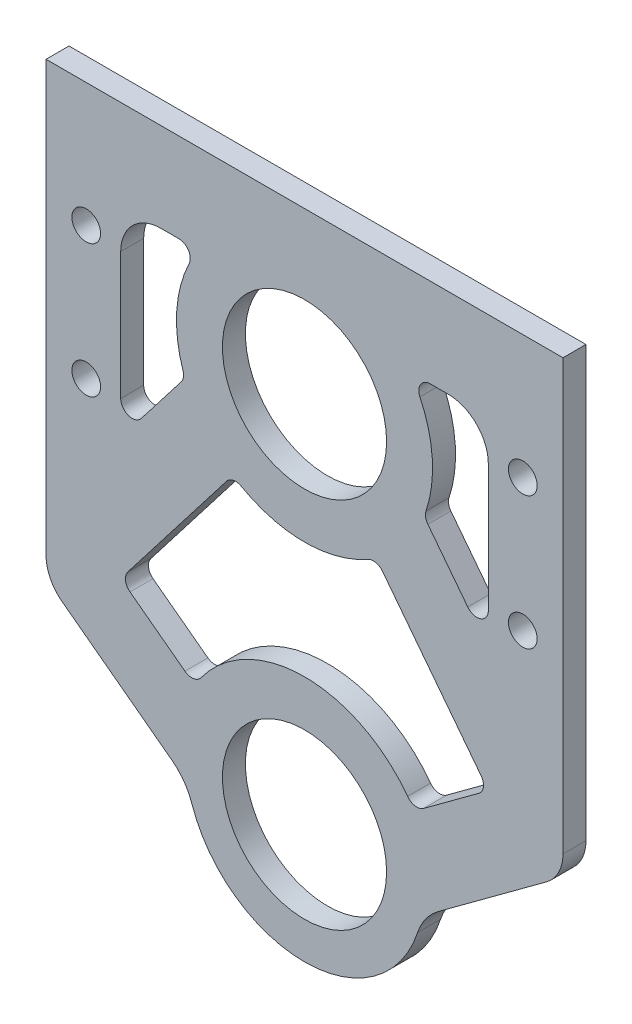
from build123d import *

# Parameters (mm, degrees)
SKETCH1_R           = 14.29
SKETCH1_R_2         = 2.5
BOSS_EXTRUDE1_DEPTH = 4


with BuildPart() as part:
    # Sketch1 → Boss-Extrude1 (new body)
    with BuildSketch(Plane.XY):
        with BuildLine():
            Line((42.153928026, 12.438673777), (23.259125181, -1.491803793))
            ThreePointArc((23.259125181, -1.491803793), (21.087687699, -3.684227098), (19.688057389, -6.434299039))
            ThreePointArc((19.688057389, -6.434299039), (17.183961156, -11.564224439), (13.374639809, -15.815777498))
            ThreePointArc((13.374639809, -15.815777498), (-5.55728281, -19.953356), (-19.624705783, -6.625007986))
            ThreePointArc((-19.624705783, -6.625007986), (-20.997947453, -3.961204504), (-23.098831149, -1.823933026))
            Line((-23.098831149, -1.823933026), (-42.200396688, 12.504304927))
            ThreePointArc((-42.200396688, 12.504304927), (-44.261108051, 14.973735796), (-45.00000949, 18.104014507))
            Line((-45.00000949, 18.104014507), (-45.00000949, 85.67919791))
            Line((-45.00000949, 85.67919791), (-45.00000949, 92.880351926))
            Line((-45.00000949, 92.880351926), (44.99999051, 92.880351926))
            Line((44.99999051, 92.880351926), (44.99999051, 90.002365232))
            Line((44.99999051, 90.002365232), (44.99999051, 18.072926444))
            ThreePointArc((44.99999051, 18.072926444), (44.248092726, 14.916786603), (42.153928026, 12.438673777))
        make_face()
        Circle(SKETCH1_R, mode=Mode.SUBTRACT)
        with Locations((0, 64.87)):
            Circle(SKETCH1_R, mode=Mode.SUBTRACT)
        with Locations((37.99999051, 48.238911282)):
            Circle(SKETCH1_R_2, mode=Mode.SUBTRACT)
        with Locations((37.99999051, 71.343473564)):
            Circle(SKETCH1_R_2, mode=Mode.SUBTRACT)
        with Locations(Location((-37.99999051, 48.238911282, 0), (0, 0, 180))):
            Circle(SKETCH1_R_2, mode=Mode.SUBTRACT)
        with Locations(Location((-37.99999051, 71.343473564, 0), (0, 0, 180))):
            Circle(SKETCH1_R_2, mode=Mode.SUBTRACT)
        with BuildLine():
            Line((13.574400229, 44.968526689), (30.750314435, 22.722318802))
            ThreePointArc((30.750314435, 22.722318802), (31.147959551, 21.222946572), (30.35409022, 19.890276241))
            Line((30.35409022, 19.890276241), (20.739573812, 12.80182942))
            ThreePointArc((20.739573812, 12.80182942), (19.25353688, 12.434122338), (17.942793433, 13.224986345))
            ThreePointArc((17.942793433, 13.224986345), (-0.05305295, 22.289936864), (-18.005544161, 13.139424624))
            ThreePointArc((-18.005544161, 13.139424624), (-19.325388182, 12.340361548), (-20.821226271, 12.718460012))
            Line((-20.821226271, 12.718460012), (-30.377654795, 19.886813915))
            ThreePointArc((-30.377654795, 19.886813915), (-31.159381655, 21.217806836), (-30.760607673, 22.708987023))
            Line((-30.760607673, 22.708987023), (-13.574400229, 44.968526689))
            ThreePointArc((-13.574400229, 44.968526689), (-12.385736887, 45.706997131), (-11.003989114, 45.485564914))
            ThreePointArc((-11.003989114, 45.485564914), (0, 42.58), (11.003989114, 45.485564914))
            ThreePointArc((11.003989114, 45.485564914), (12.385736887, 45.706997131), (13.574400229, 44.968526689))
        make_face(mode=Mode.SUBTRACT)
        with BuildLine():
            Line((21.895204833, 77.38684864), (24.99999051, 77.38684864))
            ThreePointArc((24.99999051, 77.38684864), (29.949737978, 75.336596108), (31.99999051, 70.38684864))
            Line((31.99999051, 70.38684864), (31.99999051, 48.238911282))
            ThreePointArc((31.99999051, 48.238911282), (30.645696708, 46.346013105), (28.416927004, 47.016655197))
            Line((28.416927004, 47.016655197), (21.474414878, 56.008582273))
            ThreePointArc((21.474414878, 56.008582273), (21.085896999, 56.894881748), (21.158962255, 57.859834788))
            ThreePointArc((21.158962255, 57.859834788), (22.244467277, 66.293999852), (20.092388461, 74.520908036))
            ThreePointArc((20.092388461, 74.520908036), (20.202295915, 76.451770889), (21.895204833, 77.38684864))
        make_face(mode=Mode.SUBTRACT)
        with BuildLine():
            Line((-31.99999051, 70.38684864), (-31.99999051, 48.238911282))
            ThreePointArc((-31.99999051, 48.238911282), (-30.645696708, 46.346013105), (-28.416927004, 47.016655197))
            Line((-28.416927004, 47.016655197), (-21.474414878, 56.008582273))
            ThreePointArc((-21.474414878, 56.008582273), (-21.085896999, 56.894881748), (-21.158962255, 57.859834788))
            ThreePointArc((-21.158962255, 57.859834788), (-22.244467277, 66.293999852), (-20.092388461, 74.520908036))
            ThreePointArc((-20.092388461, 74.520908036), (-20.202295915, 76.451770889), (-21.895204833, 77.38684864))
            Line((-21.895204833, 77.38684864), (-24.99999051, 77.38684864))
            ThreePointArc((-24.99999051, 77.38684864), (-29.949737978, 75.336596108), (-31.99999051, 70.38684864))
        make_face(mode=Mode.SUBTRACT)
    extrude(amount=BOSS_EXTRUDE1_DEPTH)


solid = part.part
